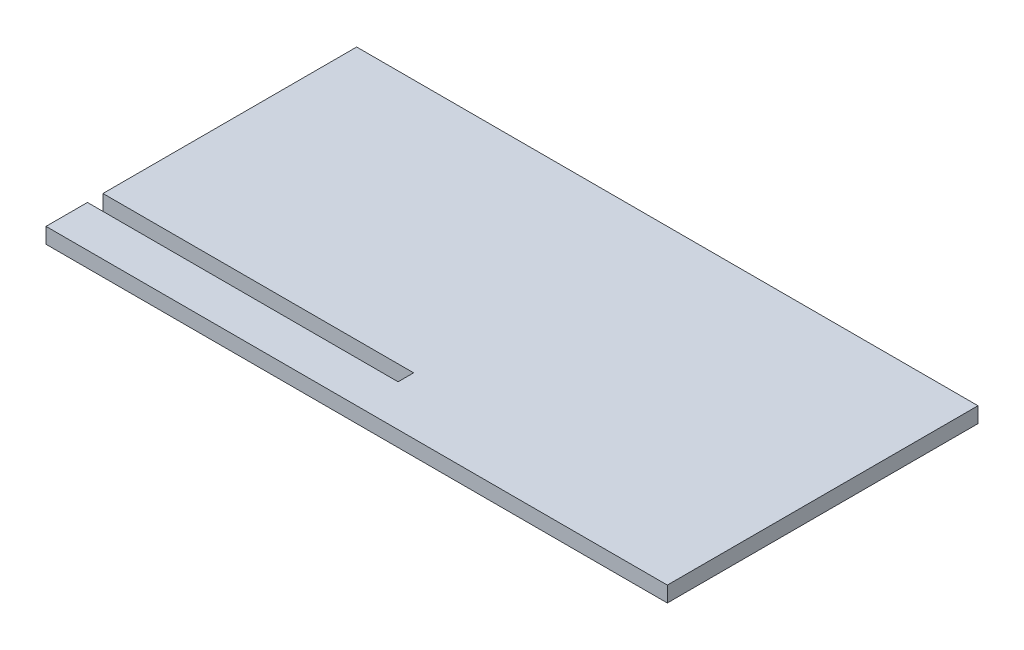
from build123d import *

# Parameters (mm, degrees)
BOSS_EXTRUDE1_DEPTH = 3


with BuildPart() as part:
    # Sketch1 → Boss-Extrude1 (new body)
    with BuildSketch(Plane(origin=(0, 0, 0), x_dir=(1, 0, 0), z_dir=(0, 1, 0))):
        Polygon((-60, 40), (-60, -9), (0, -9), (0, -12), (-60, -12), (-60, -20), (60, -20), (60, 40), align=None)
    extrude(amount=BOSS_EXTRUDE1_DEPTH)


solid = part.part
